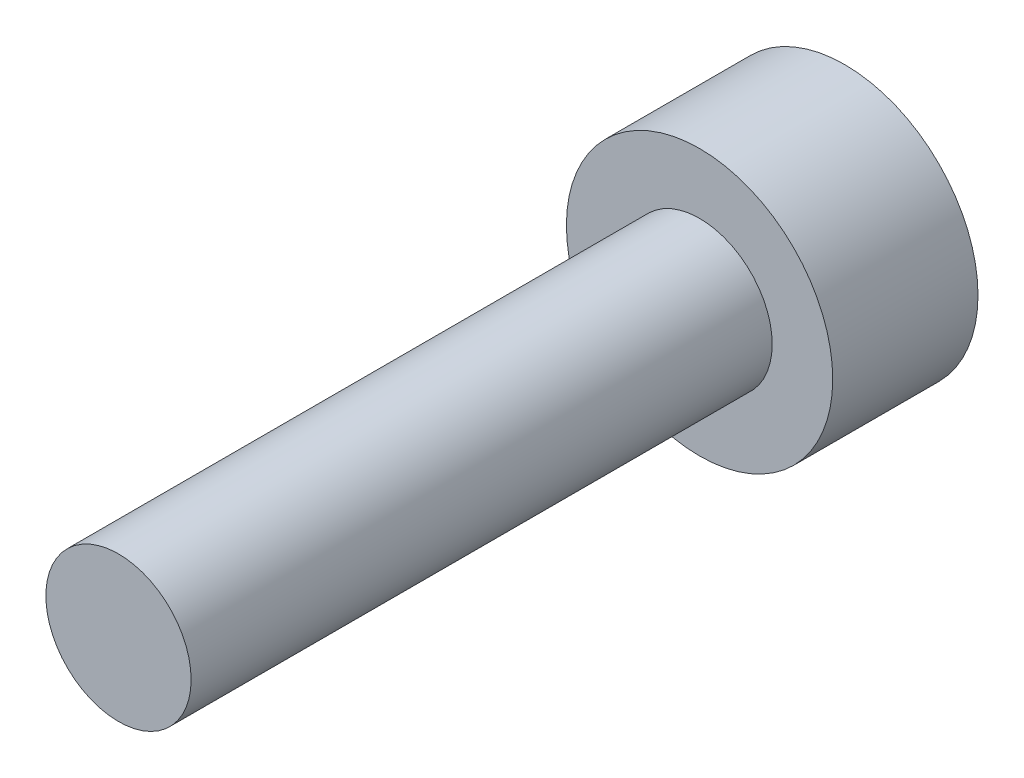
from build123d import *

# Parameters (mm, degrees)
CABEZA_START            = -3
SK_CABEZA_R             = 2.75
CABEZA_DEPTH            = 3
SK_CUERPO_R             = 1.5
CUERPO_DEPTH            = 12
HEXAGONO_INTERIOR_START = -3
HEXAGONO_INTERIOR_DEPTH = 1.5


with BuildPart() as part:
    # Sk_Cabeza → Cabeza (new body)
    with BuildSketch(Plane.XY.offset(CABEZA_START)):
        Circle(SK_CABEZA_R)
    extrude(amount=CABEZA_DEPTH)

    # Sk_Cuerpo → Cuerpo (add)
    with BuildSketch(Plane.XY):
        Circle(SK_CUERPO_R)
    extrude(amount=CUERPO_DEPTH)

    # Sk_Hexagono_interior → Hexagono_interior (cut)
    with BuildSketch(Plane.XY.offset(HEXAGONO_INTERIOR_START)):
        Polygon((0, -1.443375673), (1.25, -0.721687836), (1.25, 0.721687836), (0, 1.443375673), (-1.25, 0.721687836), (-1.25, -0.721687836), align=None)
    extrude(amount=HEXAGONO_INTERIOR_DEPTH, mode=Mode.SUBTRACT)


solid = part.part
